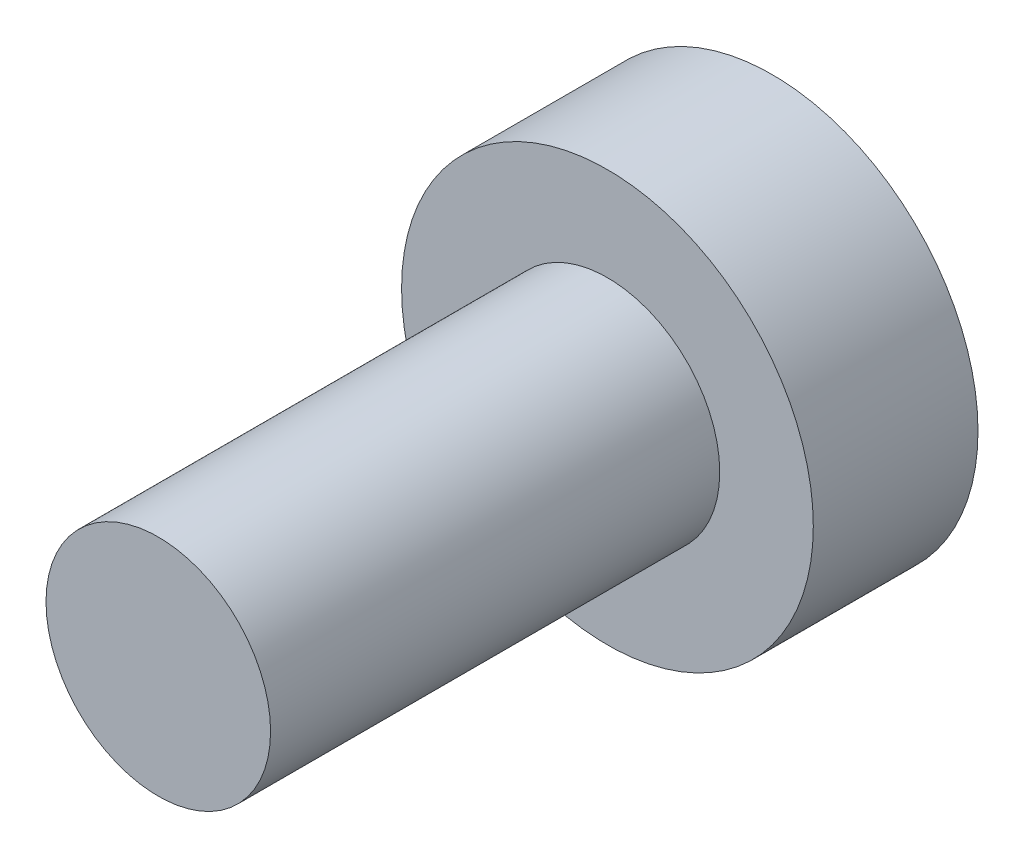
from build123d import *

# Parameters (mm, degrees)
SKETCH_1_R      = 2.75
EXTRUDE_1_DEPTH = 2.2
SKETCH_2_R      = 1.5
EXTRUDE_2_DEPTH = 6


with BuildPart() as part:
    # 草图1 → 凸台-拉伸1 (new body)
    with BuildSketch(Plane.XY):
        Circle(SKETCH_1_R)
    extrude(amount=EXTRUDE_1_DEPTH)

    # 草图2 → 凸台-拉伸2 (add)
    with BuildSketch(Plane.XY.offset(2.2)):
        Circle(SKETCH_2_R)
    extrude(amount=EXTRUDE_2_DEPTH)


solid = part.part
